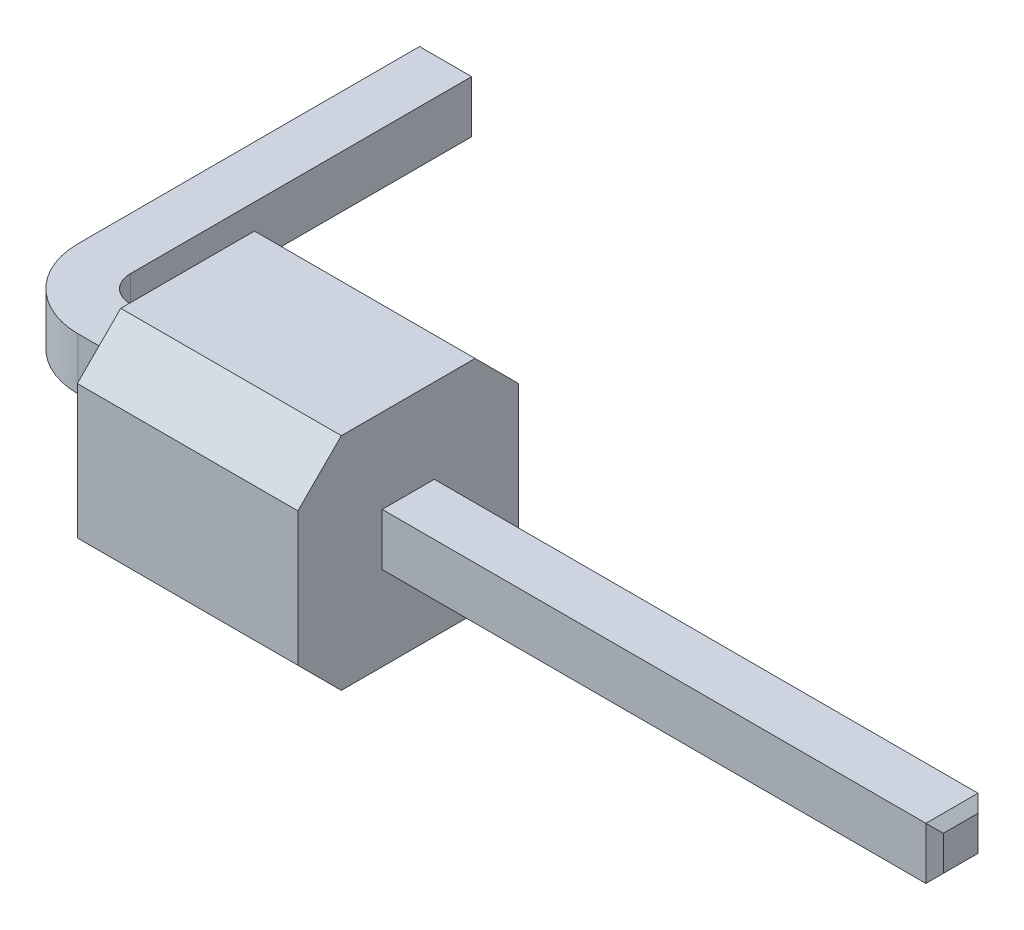
from build123d import *

# Parameters (mm, degrees)
PLASTIC_DEPTH = 2.54
CONTACT_DEPTH = 0.3
CHAMFER1_SIZE = 0.1


with BuildPart() as part:
    # Sketch1 → Plastic (new body)
    with BuildSketch(Plane(origin=(0, 0, 0), x_dir=(0, 0, -1), z_dir=(1, 0, 0))):
        Polygon((-2.04, 1.27), (-0.5, 1.27), (0, 0.77), (0, -0.77), (-0.5, -1.27), (-2.04, -1.27), (-2.54, -0.77), (-2.54, 0.77), align=None)
    extrude(amount=PLASTIC_DEPTH)

    # Sketch2 → Contact (add, symmetric)
    with BuildSketch(Plane(origin=(0, 0, 0), x_dir=(1, 0, 0), z_dir=(0, 1, 0))):
        with BuildLine():
            Line((-1.86, 3.36), (-1.86, -0.67))
            ThreePointArc((-1.86, -0.67), (-1.596396103, -1.306396103), (-0.96, -1.57))
            Line((-0.96, -1.57), (8.9, -1.57))
            Line((8.9, -1.57), (8.9, -0.97))
            Line((8.9, -0.97), (-0.96, -0.97))
            ThreePointArc((-0.96, -0.97), (-1.172132034, -0.882132034), (-1.26, -0.67))
            Line((-1.26, -0.67), (-1.26, 3.36))
            Line((-1.26, 3.36), (-1.86, 3.36))
        make_face()
    extrude(amount=CONTACT_DEPTH, both=True)

    # Chamfer1
    chamfer1_edges = [part.edges().sort_by_distance(p)[0] for p in [
        (8.9, 0, 0.97),
        (8.9, 0.3, 1.27),
        (-1.56, -0.3, -3.36),
        (-1.26, 0, -3.36),
        (-1.86, 0, -3.36),
        (8.9, -0.3, 1.27),
        (8.9, 0, 1.57),
        (-1.56, 0.3, -3.36),
    ]]
    chamfer(chamfer1_edges, length=CHAMFER1_SIZE)


solid = part.part
